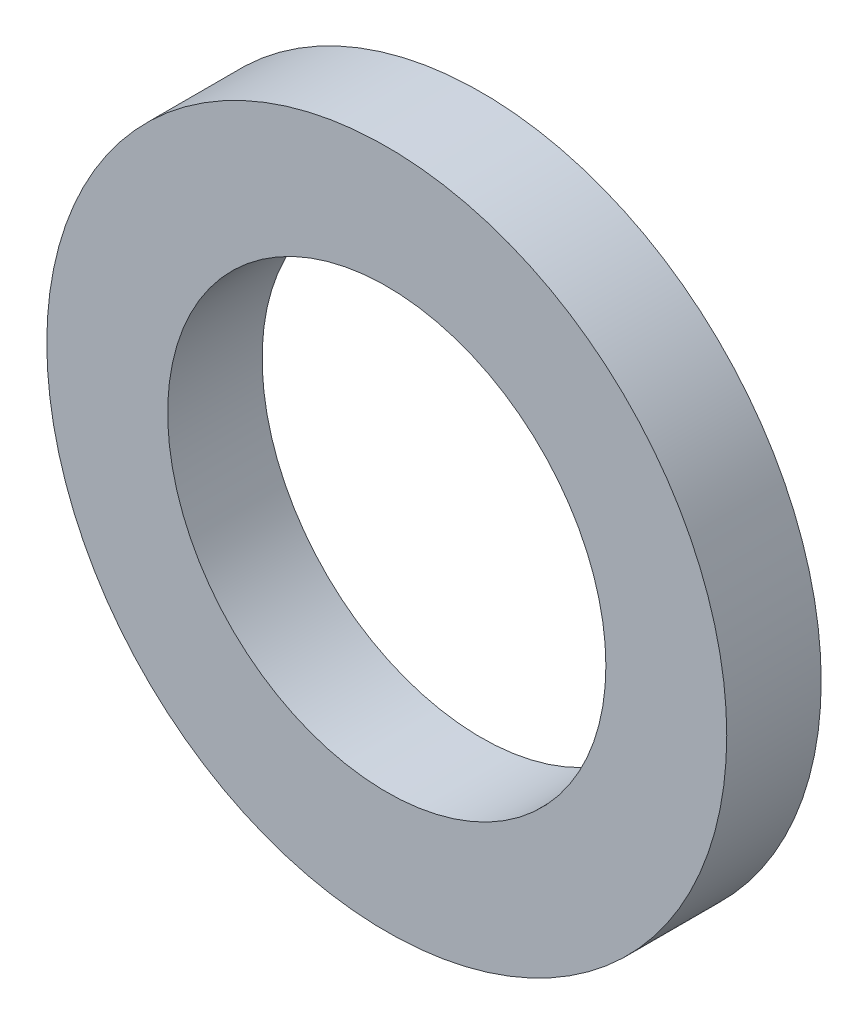
from build123d import *

# Parameters (mm, degrees)
SKETCH1_R           = 9
SKETCH1_R_2         = 5.8
BOSS_EXTRUDE1_DEPTH = 2.5


with BuildPart() as part:
    # Sketch1 → Boss-Extrude1 (new body)
    with BuildSketch(Plane.XY):
        Circle(SKETCH1_R)
        Circle(SKETCH1_R_2, mode=Mode.SUBTRACT)
    extrude(amount=BOSS_EXTRUDE1_DEPTH)


solid = part.part
